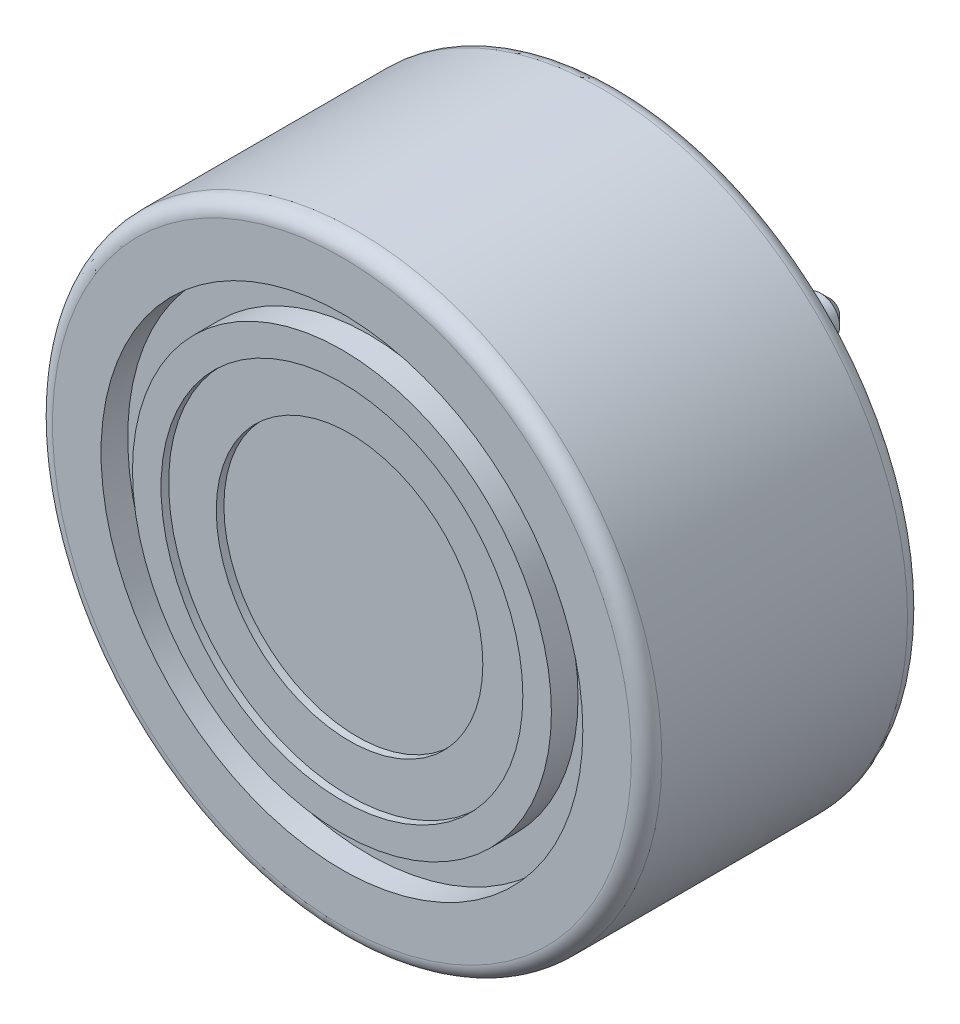
from build123d import *

# Parameters (mm, degrees)
SKETCH_1_R          = 16
EXTRUDE_1_DEPTH     = 14.5
SKETCH_2_R          = 12
SKETCH_2_R_2        = 10.9
EXTRUDE_2_DEPTH     = 1.4
SKETCH_3_R          = 10.9
EXTRUDE_3_DEPTH     = 1
SKETCH_4_R          = 12.65
SKETCH_4_R_2        = 11
CUT_EXTRUDE_1_DEPTH = 1.4
SKETCH_5_R          = 9.5
CUT_EXTRUDE_2_DEPTH = 0.4
SKETCH_6_R          = 7
CUT_EXTRUDE_3_DEPTH = 0.4
SKETCH_7_R          = 1
EXTRUDE_4_DEPTH     = 4.2
CHAMFER_1_SIZE      = 0.5
FILLET_1_R          = 0.8
FILLET_2_R          = 0.2


with BuildPart() as part:
    # Эскиз1 → Бобышка-Вытянуть1 (new body)
    with BuildSketch(Plane.XY):
        with Locations(Location((0, 0, 0), (0, 0, 180))):
            Circle(SKETCH_1_R)
    extrude(amount=EXTRUDE_1_DEPTH)

    # Эскиз2 → Бобышка-Вытянуть2 (add)
    with BuildSketch(Plane(origin=(0, 0, 0), x_dir=(-1, 0, 0), z_dir=(0, 0, -1))):
        with Locations(Location((0, 0, 0), (0, 0, 180))):
            Circle(SKETCH_2_R)
        Circle(SKETCH_2_R_2, mode=Mode.SUBTRACT)
    extrude(amount=EXTRUDE_2_DEPTH)

    # Эскиз3 → Бобышка-Вытянуть3 (add)
    with BuildSketch(Plane(origin=(0, 0, 0), x_dir=(-1, 0, 0), z_dir=(0, 0, -1))):
        Circle(SKETCH_3_R)
    extrude(amount=EXTRUDE_3_DEPTH)

    # Эскиз4 → Вырез-Вытянуть1 (cut)
    with BuildSketch(Plane.XY.offset(14.5)):
        Circle(SKETCH_4_R)
        Circle(SKETCH_4_R_2, mode=Mode.SUBTRACT)
    extrude(amount=-CUT_EXTRUDE_1_DEPTH, mode=Mode.SUBTRACT)

    # Эскиз5 → Вырез-Вытянуть2 (cut)
    with BuildSketch(Plane.XY.offset(14.5)):
        Circle(SKETCH_5_R)
    extrude(amount=-CUT_EXTRUDE_2_DEPTH, mode=Mode.SUBTRACT)

    # Эскиз6 → Вырез-Вытянуть3 (cut)
    with BuildSketch(Plane.XY.offset(14.1)):
        Circle(SKETCH_6_R)
    extrude(amount=-CUT_EXTRUDE_3_DEPTH, mode=Mode.SUBTRACT)

    # Эскиз7 → Бобышка-Вытянуть4 (add)
    with BuildSketch(Plane(origin=(0, 0, -1), x_dir=(-1, 0, 0), z_dir=(0, 0, -1))):
        with Locations((-8.4, 0)):
            Circle(SKETCH_7_R)
        with Locations((8.4, 0)):
            Circle(SKETCH_7_R)
        with Locations((-5.938994048, -5.940399793)):
            Circle(SKETCH_7_R)
        with Locations((-5.938994048, 5.940399793)):
            Circle(SKETCH_7_R)
    extrude(amount=EXTRUDE_4_DEPTH)

    # Фаска1
    chamfer_1_edges = [part.edges().sort_by_distance(p)[0] for p in [
        (9.4, 0, -5.2),
        (-7.4, 0, -5.2),
        (6.938994048, -5.940399793, -5.2),
        (6.938994048, 5.940399793, -5.2),
    ]]
    chamfer(chamfer_1_edges, length=CHAMFER_1_SIZE)

    # Скругление1
    fillet_1_edges = [part.edges().sort_by_distance(p)[0] for p in [
        (16, 0, 0),
        (16, 0, 14.5),
    ]]
    fillet(fillet_1_edges, radius=FILLET_1_R)

    # Скругление2
    fillet_2_edges = [part.edges().sort_by_distance(p)[0] for p in [
        (-12, 0, -1.4),
        (10.9, 0, -1.4),
    ]]
    fillet(fillet_2_edges, radius=FILLET_2_R)


solid = part.part
